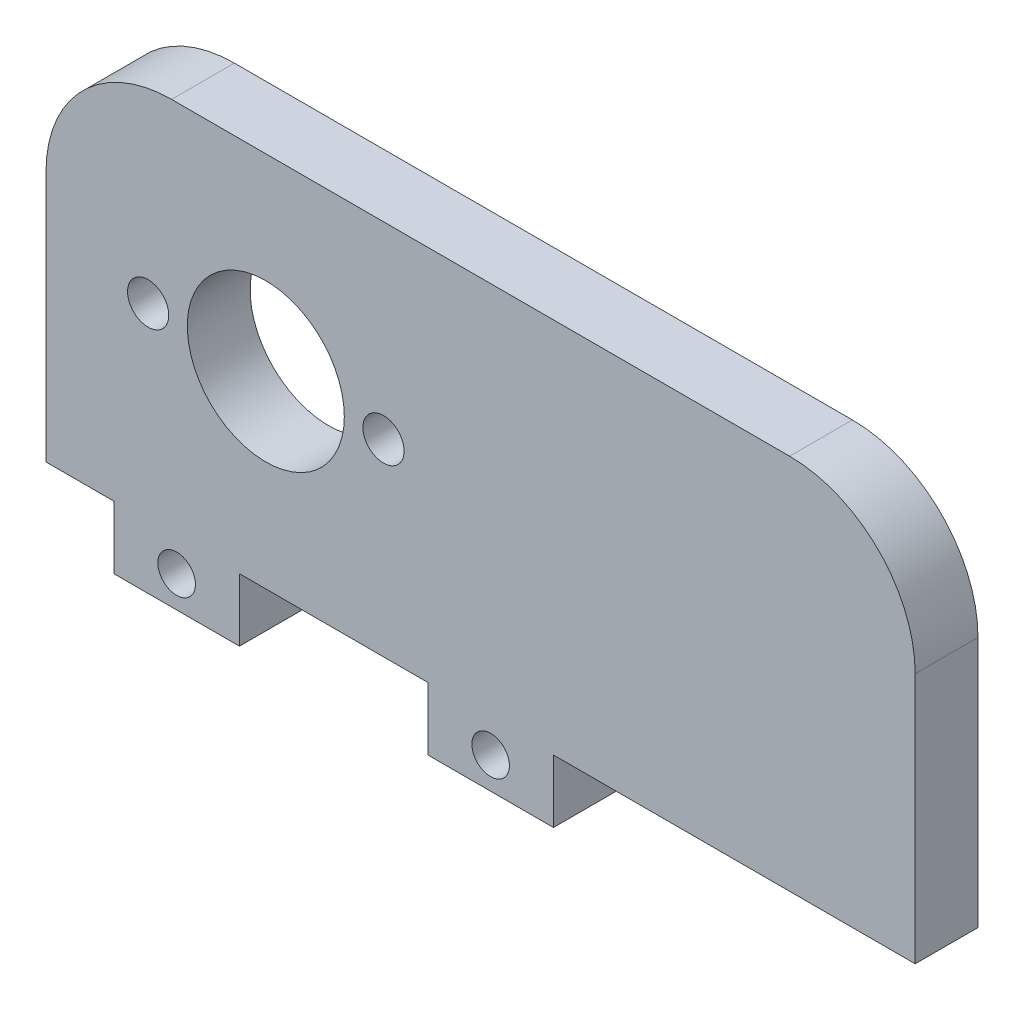
from build123d import *

# Parameters (mm, degrees)
SKETCH2_W                 = 87.884
SKETCH2_H                 = 44.45
BOSS_EXTRUDE1_DEPTH       = 3.175
CUT_EXTRUDE1_REACH        = 51.651
SKETCH3_R                 = 7.9375
F_8_CLEARANCE_HOLE1_D     = 4.1656
CIRPATTERN1_COUNT         = 2
CUT_EXTRUDE2_REACH        = 51.651
SKETCH6_W                 = 6.858
SKETCH6_H                 = 6.35
SKETCH6_W_2               = 19.05
SKETCH6_W_3               = 36.576
F_6_CLEARANCE_HOLE1_D     = 3.7973
F_6_CLEARANCE_HOLE1_DEPTH = 6.35
F_6_CLEARANCE_HOLE1_TIP   = 1.140824014
FILLET1_R                 = 12.7


with BuildPart() as part:
    # Sketch2 → Boss-Extrude1 (new, symmetric)
    with BuildSketch(Plane.XY):
        Rectangle(SKETCH2_W, SKETCH2_H)
    extrude(amount=BOSS_EXTRUDE1_DEPTH, both=True)

    # Sketch3 → Cut-Extrude1 (cut, up to next)
    with BuildSketch(Plane.XY.offset(3.175), mode=Mode.PRIVATE) as cut_extrude1_sk1:
        with Locations((-21.717, 3.175)):
            Circle(SKETCH3_R)
    cut_extrude1_tool1 = extrude(cut_extrude1_sk1.sketch, amount=-CUT_EXTRUDE1_REACH, mode=Mode.PRIVATE) & part.part
    add(cut_extrude1_tool1.solids().sort_by_distance((-21.717, 3.175, 3.175))[0], mode=Mode.SUBTRACT)

    # #8 Clearance Hole1 (through all)
    with Locations(Plane.XY.offset(3.175)):
        with Locations((-33.6169, 3.175)):
            f_8_clearance_hole1 = Hole(F_8_CLEARANCE_HOLE1_D / 2)

    # CirPattern1: #8 Clearance Hole1 ×2 about axis
    cirpattern1_axis = Axis((-21.717, 3.175, 0), (0, 0, 1))
    for i in range(1, CIRPATTERN1_COUNT):
        add(f_8_clearance_hole1.rotate(cirpattern1_axis, i * 360 / CIRPATTERN1_COUNT), mode=Mode.SUBTRACT)

    # Sketch6 → Cut-Extrude2 (cut, up to next)
    with BuildSketch(Plane.XY.offset(3.175), mode=Mode.PRIVATE) as cut_extrude2_sk1:
        with Locations((-40.513, -19.05)):
            Rectangle(SKETCH6_W, SKETCH6_H)
    cut_extrude2_tool1 = extrude(cut_extrude2_sk1.sketch, amount=-CUT_EXTRUDE2_REACH, mode=Mode.PRIVATE) & part.part
    # Sketch6 → Cut-Extrude2 (cut, up to next)
    with BuildSketch(Plane.XY.offset(3.175), mode=Mode.PRIVATE) as cut_extrude2_sk2:
        with Locations((-14.859, -19.05)):
            Rectangle(SKETCH6_W_2, SKETCH6_H)
    cut_extrude2_tool2 = extrude(cut_extrude2_sk2.sketch, amount=-CUT_EXTRUDE2_REACH, mode=Mode.PRIVATE) & part.part
    # Sketch6 → Cut-Extrude2 (cut, up to next)
    with BuildSketch(Plane.XY.offset(3.175), mode=Mode.PRIVATE) as cut_extrude2_sk3:
        with Locations((25.654, -19.05)):
            Rectangle(SKETCH6_W_3, SKETCH6_H)
    cut_extrude2_tool3 = extrude(cut_extrude2_sk3.sketch, amount=-CUT_EXTRUDE2_REACH, mode=Mode.PRIVATE) & part.part
    add(cut_extrude2_tool1.solids().sort_by_distance((-40.513, -19.05, 3.175))[0], mode=Mode.SUBTRACT)
    add(cut_extrude2_tool2.solids().sort_by_distance((-14.859, -19.05, 3.175))[0], mode=Mode.SUBTRACT)
    add(cut_extrude2_tool3.solids().sort_by_distance((25.654, -19.05, 3.175))[0], mode=Mode.SUBTRACT)

    # #6 Clearance Hole1
    with Locations(Plane.XY.offset(3.175)):
        with Locations((1.016, -19.05), (-30.734, -19.05)):
            Hole(F_6_CLEARANCE_HOLE1_D / 2, depth=F_6_CLEARANCE_HOLE1_DEPTH)
            with Locations((0, 0, -(F_6_CLEARANCE_HOLE1_DEPTH + F_6_CLEARANCE_HOLE1_TIP / 2))):  # 118° drill point
                Cone(0, F_6_CLEARANCE_HOLE1_D / 2, F_6_CLEARANCE_HOLE1_TIP, mode=Mode.SUBTRACT)

    # Fillet1
    fillet1_edges = [part.edges().sort_by_distance(p)[0] for p in [
        (-43.942, 22.225, 0),
        (43.942, 22.225, 0),
    ]]
    fillet(fillet1_edges, radius=FILLET1_R)


solid = part.part
